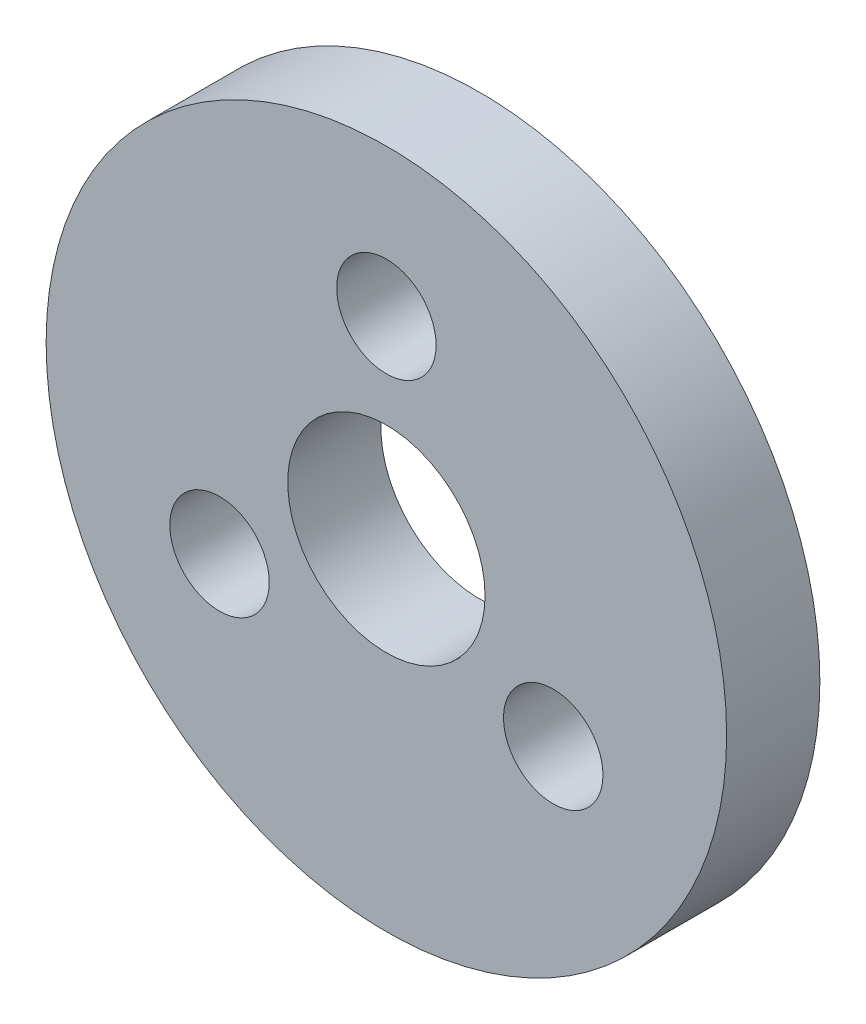
from build123d import *

# Parameters (mm, degrees)
SKETCH1_R            = 10.95
SKETCH1_R_2          = 3.175
BOSS_EXTRUDE1_DEPTH  = 3
M3_CLEARANCE_HOLE1_D = 3.2


with BuildPart() as part:
    # Sketch1 → Boss-Extrude1 (new body)
    with BuildSketch(Plane.XY):
        Circle(SKETCH1_R)
        Circle(SKETCH1_R_2, mode=Mode.SUBTRACT)
    extrude(amount=BOSS_EXTRUDE1_DEPTH)

    # M3 Clearance Hole1 (through all)
    with Locations(Plane.XY.offset(3)):
        with Locations((0, 6.2), (-5.369357503, -3.1), (5.369357503, -3.1)):
            Hole(M3_CLEARANCE_HOLE1_D / 2)


solid = part.part
